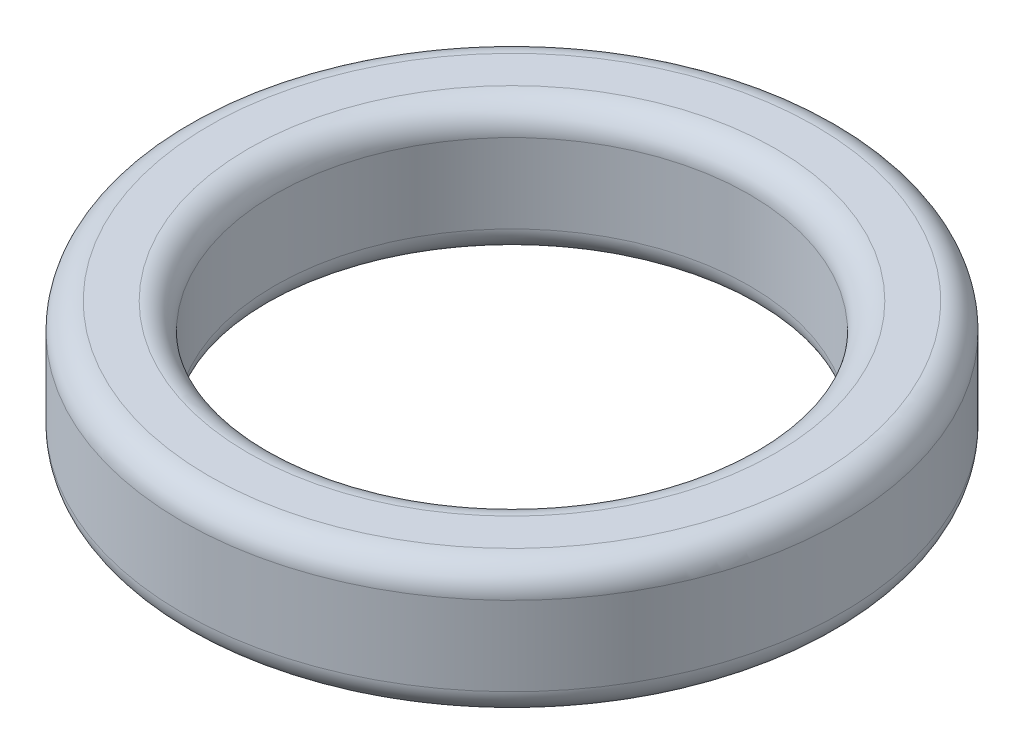
from build123d import *

# Parameters (mm, degrees)
SKETCH1_R           = 3.175
SKETCH1_R_2         = 2.286
BOSS_EXTRUDE1_DEPTH = 1.27
FILLET2_R           = 0.254


with BuildPart() as part:
    # Sketch1 → Boss-Extrude1 (new body)
    with BuildSketch(Plane(origin=(0, 0, 0), x_dir=(1, 0, 0), z_dir=(0, 1, 0))):
        with Locations(Location((0, 0, 0), (0, 0, 270))):
            Circle(SKETCH1_R)
        with Locations(Location((0, 0, 0), (0, 0, 270))):
            Circle(SKETCH1_R_2, mode=Mode.SUBTRACT)
    extrude(amount=BOSS_EXTRUDE1_DEPTH)

    # Fillet2
    fillet2_edges = [part.edges().sort_by_distance(p)[0] for p in [
        (0, 0, -3.175),
        (0, 1.27, -3.175),
        (0, 0, -2.286),
        (0, 1.27, -2.286),
    ]]
    fillet(fillet2_edges, radius=FILLET2_R)


solid = part.part
